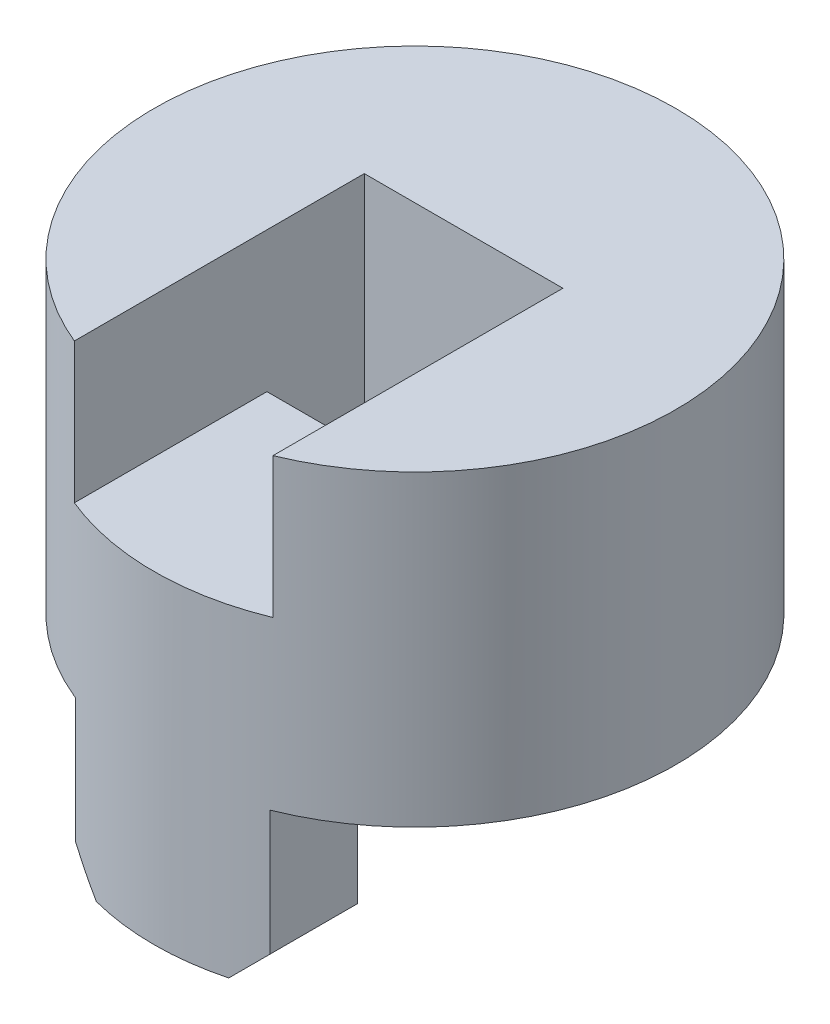
from build123d import *
from build123d.topology import SkipClean

# Parameters (mm, degrees)
SKETCH1_R           = 3.45
BOSS_EXTRUDE1_DEPTH = 1.1
SKETCH2_R           = 6.7
BOSS_EXTRUDE2_DEPTH = 4.3
SKETCH3_W           = 5.1
SKETCH3_H           = 2.5
CUT_EXTRUDE1_DEPTH  = 11.905961672
BOSS_EXTRUDE3_START = 4
BOSS_EXTRUDE3_DEPTH = 4
CHAMFER1_SIZE       = 0.8
BOSS_EXTRUDE4_DEPTH = 3.6


with BuildPart() as part:
    # Sketch1 → Boss-Extrude1 (new body)
    with BuildSketch(Plane(origin=(0, 0, 0), x_dir=(1, 0, 0), z_dir=(0, 1, 0))):
        with Locations(Location((0, 0, 0), (0, 0, 270))):
            Circle(SKETCH1_R)
    extrude(amount=BOSS_EXTRUDE1_DEPTH)

    # Sketch2 → Boss-Extrude2 (add)
    with BuildSketch(Plane(origin=(0, 1.1, 0), x_dir=(1, 0, 0), z_dir=(0, 1, 0))):
        with Locations(Location((0, 0, 0), (0, 0, 90))):
            Circle(SKETCH2_R)
    extrude(amount=BOSS_EXTRUDE2_DEPTH)

    # Sketch3 → Cut-Extrude1 (cut, through all)
    with BuildSketch(Plane(origin=(0, 5.4, 0), x_dir=(1, 0, 0), z_dir=(0, 1, 0))):
        Rectangle(SKETCH3_W, SKETCH3_H)
    extrude(amount=-CUT_EXTRUDE1_DEPTH, mode=Mode.SUBTRACT)

    # Sketch4 → Boss-Extrude3 (add)
    with SkipClean():  # the faces are left unmerged after this step: merging them gives an invalid solid
        with BuildSketch(Plane.XZ.offset(-1.1).offset(BOSS_EXTRUDE3_START)):
            with BuildLine():
                ThreePointArc((2.5, 6.216108107), (0, 6.7), (-2.5, 6.216108107))
                Line((-2.5, 6.216108107), (-2.5, 3.979949748))
                ThreePointArc((-2.5, 3.979949748), (0, 4.7), (2.5, 3.979949748))
                Line((2.5, 3.979949748), (2.5, 6.216108107))
            make_face()
        extrude(amount=-BOSS_EXTRUDE3_DEPTH)

    # Chamfer1
    chamfer1_edges = [part.edges().sort_by_distance(p)[0] for p in [
        (-2.5, -2.9, 5.098028928),
        (2.5, -2.9, 5.098028928),
    ]]
    chamfer(chamfer1_edges, length=CHAMFER1_SIZE)

    # Sketch5 → Boss-Extrude4 (add)
    with SkipClean():  # the faces are left unmerged after this step: merging them gives an invalid solid
        with BuildSketch(Plane(origin=(0, 5.4, 0), x_dir=(1, 0, 0), z_dir=(0, 1, 0))):
            with BuildLine():
                Line((-2.55, -1.25), (-2.55, 1.25))
                Line((-2.55, 1.25), (2.55, 1.25))
                Line((2.55, 1.25), (2.55, -1.25))
                Line((2.55, -1.25), (2.55, -6.195764682))
                ThreePointArc((2.55, -6.195764682), (5.566641717, -3.728605638), (6.7, 0))
                ThreePointArc((6.7, 0), (-3.728605638, 5.566641717), (-2.55, -6.195764682))
                Line((-2.55, -6.195764682), (-2.55, -1.25))
            make_face()
        extrude(amount=BOSS_EXTRUDE4_DEPTH)


solid = part.part
